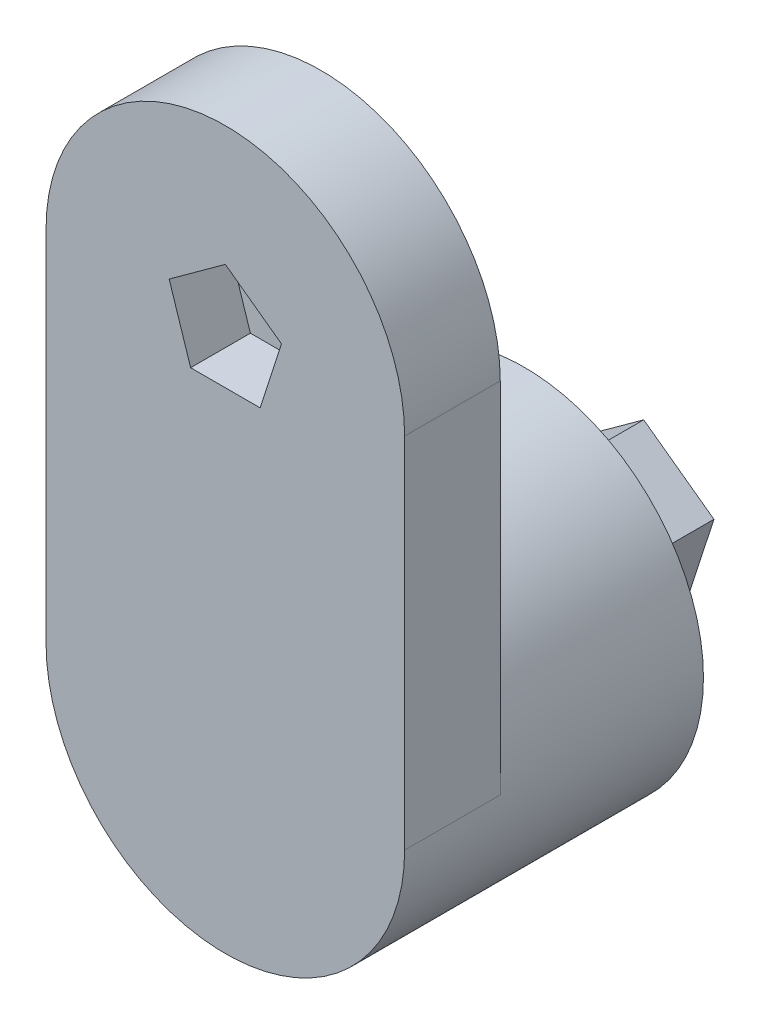
from build123d import *

# Parameters (mm, degrees)
EXTRUDE_1_DEPTH     = 8
CUT_EXTRUDE_1_DEPTH = 5
EXTRUDE_START       = 17
SKETCH_3_R          = 15
EXTRUDE_2_DEPTH     = 17
EXTRUDE_3_DEPTH     = 10


with BuildPart() as part:
    # 스케치1 → 보스-돌출1 (new body)
    with BuildSketch(Plane.XY):
        with BuildLine():
            Line((-15, 15), (-15, -15))
            ThreePointArc((-15, -15), (0, -30), (15, -15))
            Line((15, -15), (15, 15))
            ThreePointArc((15, 15), (0, 30), (-15, 15))
        make_face()
    extrude(amount=EXTRUDE_1_DEPTH)

    # 스케치2 → 컷-돌출1 (cut)
    with BuildSketch(Plane.XY.offset(8)):
        Polygon((0, 19.942281197), (-4.700388737, 16.527248881), (-2.905, 11.001610521), (2.905, 11.001610521), (4.700388737, 16.527248881), align=None)
    extrude(amount=-CUT_EXTRUDE_1_DEPTH, mode=Mode.SUBTRACT)

    # 스케치3 → 보스-돌출2 (add)
    with BuildSketch(Plane(origin=(0, 0, 0), x_dir=(-1, 0, 0), z_dir=(0, 0, -1)).offset(EXTRUDE_START)):
        with Locations((0, -15)):
            Circle(SKETCH_3_R)
    extrude(amount=-EXTRUDE_2_DEPTH)

    # 스케치4 → 보스-돌출3 (add)
    with BuildSketch(Plane(origin=(0, 0, -17), x_dir=(-1, 0, 0), z_dir=(0, 0, -1))):
        Polygon((0, -8.819660113), (-5.877852523, -13.090169944), (-3.63271264, -20), (3.63271264, -20), (5.877852523, -13.090169944), align=None)
    extrude(amount=EXTRUDE_3_DEPTH)


solid = part.part
